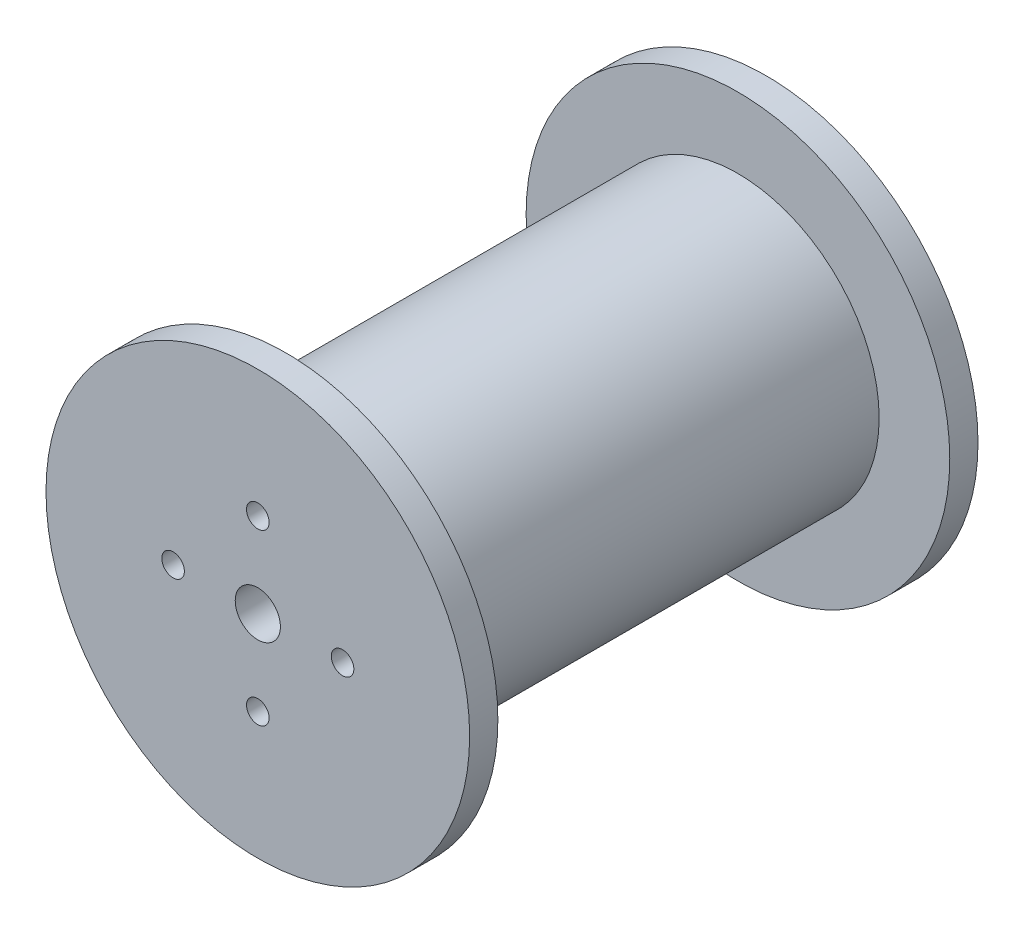
from build123d import *

# Parameters (mm, degrees)
SKETCH1_R           = 25
BOSS_EXTRUDE1_DEPTH = 80
SKETCH2_R           = 37.5
BOSS_EXTRUDE2_DEPTH = 5
BOSS_EXTRUDE3_START = 5
SKETCH3_R           = 37.5
BOSS_EXTRUDE3_DEPTH = 5
SKETCH4_R           = 4
SKETCH4_R_2         = 2
CUT_EXTRUDE1_DEPTH  = 105.462912079


with BuildPart() as part:
    # Sketch1 → Boss-Extrude1 (new body)
    with BuildSketch(Plane.XY):
        Circle(SKETCH1_R)
    extrude(amount=BOSS_EXTRUDE1_DEPTH)

    # Sketch2 → Boss-Extrude2 (add)
    with BuildSketch(Plane.XY.offset(80)):
        Circle(SKETCH2_R)
    extrude(amount=BOSS_EXTRUDE2_DEPTH)

    # Sketch3 → Boss-Extrude3 (add)
    with BuildSketch(Plane(origin=(0, 0, 0), x_dir=(-1, 0, 0), z_dir=(0, 0, -1)).offset(BOSS_EXTRUDE3_START)):
        with Locations(Location((0, 0, 0), (0, 0, 180))):
            Circle(SKETCH3_R)
    extrude(amount=-BOSS_EXTRUDE3_DEPTH)

    # Sketch4 → Cut-Extrude1 (cut, through all)
    with BuildSketch(Plane(origin=(0, 0, -5), x_dir=(-1, 0, 0), z_dir=(0, 0, -1))):
        Circle(SKETCH4_R)
        with Locations((0, 15)):
            Circle(SKETCH4_R_2)
        with Locations((15, 0)):
            Circle(SKETCH4_R_2)
        with Locations((0, -15)):
            Circle(SKETCH4_R_2)
        with Locations((-15, 0)):
            Circle(SKETCH4_R_2)
    extrude(amount=-CUT_EXTRUDE1_DEPTH, mode=Mode.SUBTRACT)


solid = part.part
